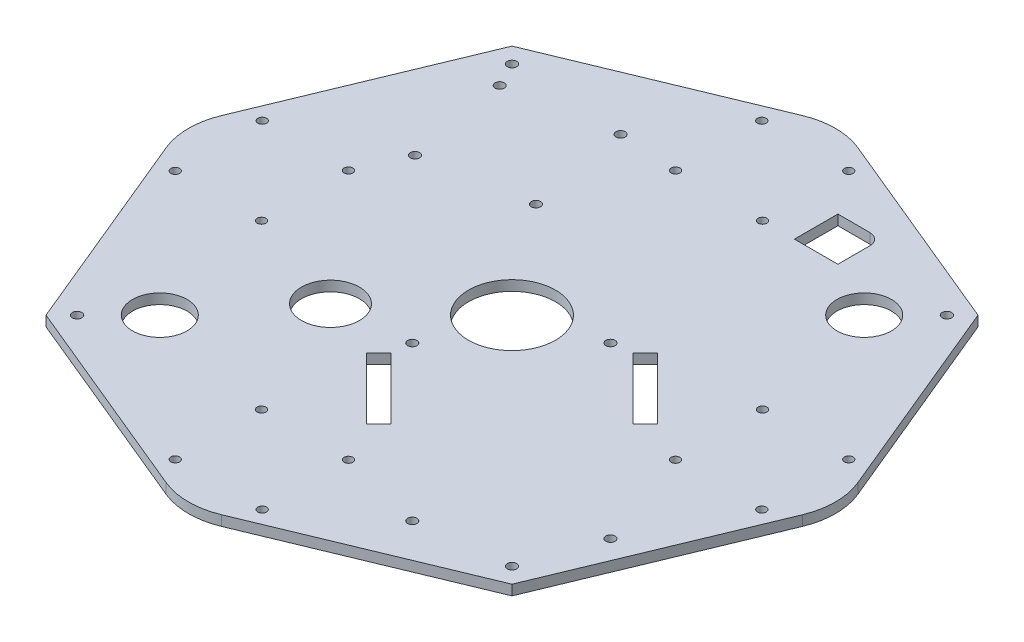
from build123d import *

# Parameters (mm, degrees)
BOSS_EXTRUDE2_DEPTH      = 3.5
CUT_EXTRUDE3_DEPTH       = 161.765145163
CUT_EXTRUDE3_DEPTH_BACK  = 161.765145163
SKETCH3_R                = 1.625
CUT_EXTRUDE6_DEPTH       = 161.765145163
CUT_EXTRUDE6_DEPTH_BACK  = 161.765145163
SKETCH6_R                = 15
SKETCH8_R                = 1.5
CUT_EXTRUDE7_DEPTH       = 3.5
CIRPATTERN1_COUNT        = 4
CUT_EXTRUDE12_DEPTH      = 161.765145163
CUT_EXTRUDE12_DEPTH_BACK = 161.765145163
SKETCH20_W               = 15
SKETCH20_H               = 15
FILLET2_R                = 25
FILLET3_R                = 4
SKETCH21_R               = 2.5
BOSS_EXTRUDE4_DEPTH      = 3
SKETCH22_R               = 1.6
CUT_EXTRUDE13_DEPTH      = 158.947840775
SKETCH24_R               = 2.4
BOSS_EXTRUDE6_DEPTH      = 3.5
CUT_EXTRUDE14_DEPTH      = 158.969207144
CUT_EXTRUDE14_DEPTH_BACK = 158.969207144
SKETCH25_R               = 1.6
CUT_EXTRUDE15_DEPTH      = 158.852844148
CUT_EXTRUDE15_DEPTH_BACK = 158.852844148
SKETCH26_R               = 9.404630818
CUT_EXTRUDE16_DEPTH      = 158.852844148
CUT_EXTRUDE16_DEPTH_BACK = 158.852844148
CUT_EXTRUDE17_DEPTH      = 158.969207144
CUT_EXTRUDE17_DEPTH_BACK = 158.969207144
SKETCH28_R               = 10


with BuildPart() as part:
    # Sketch1 → Boss-Extrude2 (new body)
    with BuildSketch(Plane(origin=(0, 0, 0), x_dir=(1, 0, 0), z_dir=(0, 1, 0))):
        Polygon((0, -113.651181031), (80.363520797, -80.363520797), (113.651181031, 0), (80.363520797, 80.363520797), (0, 113.651181031), (-80.363520797, 80.363520797), (-113.651181031, 0), (-80.363520797, -80.363520797), align=None)
    extrude(amount=BOSS_EXTRUDE2_DEPTH)

    # Sketch3 → Cut-Extrude3 (cut, two sides: drawn at the far end of the back side and taken through both)
    with BuildSketch(Plane(origin=(0, 3.5, 0), x_dir=(1, 0, 0), z_dir=(0, 1, 0)).offset(-CUT_EXTRUDE3_DEPTH_BACK)):
        with Locations(Location((-75, -75, 0), (0, 0, 270))):
            Circle(SKETCH3_R)
        with Locations(Location((75, -75, 0), (0, 0, 270))):
            Circle(SKETCH3_R)
        with Locations(Location((75, 75, 0), (0, 0, 270))):
            Circle(SKETCH3_R)
        with Locations(Location((-75, 75, 0), (0, 0, 270))):
            Circle(SKETCH3_R)
    extrude(amount=CUT_EXTRUDE3_DEPTH + CUT_EXTRUDE3_DEPTH_BACK, mode=Mode.SUBTRACT)

    # Sketch6 → Cut-Extrude6 (cut, two sides: drawn at the far end of the back side and taken through both)
    with BuildSketch(Plane(origin=(0, 3.5, 0), x_dir=(1, 0, 0), z_dir=(0, 1, 0)).offset(-CUT_EXTRUDE6_DEPTH_BACK)):
        with Locations(Location((0, 0, 0), (0, 0, 270))):
            Circle(SKETCH6_R)
    extrude(amount=CUT_EXTRUDE6_DEPTH + CUT_EXTRUDE6_DEPTH_BACK, mode=Mode.SUBTRACT)

    # Sketch8 → Cut-Extrude7 (cut)
    with BuildSketch(Plane(origin=(0, 3.5, 0), x_dir=(1, 0, 0), z_dir=(0, 1, 0))):
        with Locations(Location((-15, -71.401181031, 0), (0, 0, 270))):
            Circle(SKETCH8_R)
        with Locations(Location((15, -71.401181031, 0), (0, 0, 270))):
            Circle(SKETCH8_R)
        with Locations(Location((-15, -101.151181031, 0), (0, 0, 270))):
            Circle(SKETCH8_R)
        with Locations(Location((15, -101.151181031, 0), (0, 0, 270))):
            Circle(SKETCH8_R)
    cut_extrude7 = extrude(amount=-CUT_EXTRUDE7_DEPTH, mode=Mode.SUBTRACT)

    # CirPattern1: Cut-Extrude7 ×4 about axis
    cirpattern1_axis = Axis((0, 0, 0), (0, 1, 0))
    for i in range(1, CIRPATTERN1_COUNT):
        add(cut_extrude7.rotate(cirpattern1_axis, i * 360 / CIRPATTERN1_COUNT), mode=Mode.SUBTRACT)

    # Sketch20 → Cut-Extrude12 (cut, two sides: drawn at the far end of the back side and taken through both)
    with BuildSketch(Plane(origin=(0, 3.5, 0), x_dir=(1, 0, 0), z_dir=(0, 1, 0)).offset(-CUT_EXTRUDE12_DEPTH_BACK)):
        with Locations((33.5, 78.901181031)):
            Rectangle(SKETCH20_W, SKETCH20_H)
    extrude(amount=CUT_EXTRUDE12_DEPTH + CUT_EXTRUDE12_DEPTH_BACK, mode=Mode.SUBTRACT)

    # Fillet2
    fillet2_edges = [part.edges().sort_by_distance(p)[0] for p in [
        (-113.651181031, 1.75, 0),
        (0, 1.75, -113.651181031),
        (113.651181031, 1.75, 0),
        (0, 1.75, 113.651181031),
    ]]
    fillet(fillet2_edges, radius=FILLET2_R)

    # Fillet3
    fillet3_edges = [part.edges().sort_by_distance(p)[0] for p in [
        (41, 1.75, -86.401181031),
    ]]
    fillet(fillet3_edges, radius=FILLET3_R)

    # Sketch21 → Boss-Extrude4 (add)
    with BuildSketch(Plane.XZ):
        with Locations(Location((-8.867969273, 25.52523978, 0), (0, 0, 90))):
            Circle(SKETCH21_R)
        with Locations(Location((25.310885524, -8.653615016, 0), (0, 0, 90))):
            Circle(SKETCH21_R)
        with Locations(Location((44.25922594, 78.652434993, 0), (0, 0, 90))):
            Circle(SKETCH21_R)
        with Locations(Location((83.736431848, 49.771931307, 0), (0, 0, 90))):
            Circle(SKETCH21_R)
    extrude(amount=BOSS_EXTRUDE4_DEPTH)

    # Sketch22 → Cut-Extrude13 (cut, through all)
    with BuildSketch(Plane.XZ.offset(3)):
        with Locations(Location((83.736431848, 49.771931307, 0), (0, 0, 270))):
            Circle(SKETCH22_R)
        with Locations(Location((25.310885524, -8.653615016, 0), (0, 0, 270))):
            Circle(SKETCH22_R)
        with Locations(Location((-8.867969273, 25.52523978, 0), (0, 0, 270))):
            Circle(SKETCH22_R)
        with Locations(Location((44.25922594, 78.652434993, 0), (0, 0, 270))):
            Circle(SKETCH22_R)
    extrude(amount=-CUT_EXTRUDE13_DEPTH, mode=Mode.SUBTRACT)

    # Sketch24 → Boss-Extrude6 (add)
    with BuildSketch(Plane.XZ):
        with Locations(Location((-64.472580457, -31.0267951, 0), (0, 0, 90))):
            Circle(SKETCH24_R)
        with Locations(Location((-29.019501349, -37.278129496, 0), (0, 0, 90))):
            Circle(SKETCH24_R)
        with Locations(Location((-35.270835745, -72.731208605, 0), (0, 0, 90))):
            Circle(SKETCH24_R)
        with Locations(Location((-70.723914853, -66.479874209, 0), (0, 0, 90))):
            Circle(SKETCH24_R)
    extrude(amount=BOSS_EXTRUDE6_DEPTH)

    # Sketch25 → Cut-Extrude14 (cut, two sides: drawn at the far end of the back side and taken through both)
    with BuildSketch(Plane.XZ.offset(3.5).offset(-CUT_EXTRUDE14_DEPTH_BACK)):
        with Locations(Location((-29.019501349, -37.278129496, 0), (0, 0, 270))):
            Circle(SKETCH25_R)
        with Locations(Location((-64.472580457, -31.0267951, 0), (0, 0, 270))):
            Circle(SKETCH25_R)
        with Locations(Location((-70.723914853, -66.479874209, 0), (0, 0, 270))):
            Circle(SKETCH25_R)
        with Locations(Location((-35.270835745, -72.731208605, 0), (0, 0, 270))):
            Circle(SKETCH25_R)
    extrude(amount=CUT_EXTRUDE14_DEPTH + CUT_EXTRUDE14_DEPTH_BACK, mode=Mode.SUBTRACT)

    # Sketch26 → Cut-Extrude15 (cut, two sides: drawn at the far end of the back side and taken through both)
    with BuildSketch(Plane.XZ.offset(-CUT_EXTRUDE15_DEPTH_BACK)):
        with Locations(Location((-60.741403737, 60.741403737, 0), (0, 0, 270))):
            Circle(SKETCH26_R)
        with Locations(Location((60.741403737, -60.741403737, 0), (0, 0, 270))):
            Circle(SKETCH26_R)
    extrude(amount=CUT_EXTRUDE15_DEPTH + CUT_EXTRUDE15_DEPTH_BACK, mode=Mode.SUBTRACT)

    # Sketch27 → Cut-Extrude16 (cut, two sides: drawn at the far end of the back side and taken through both)
    with BuildSketch(Plane.XZ.offset(-CUT_EXTRUDE16_DEPTH_BACK)):
        Polygon((7.39951467, 57.553878611), (11.642155357, 53.311237924), (-9.571048078, 32.098034488), (-13.813688765, 36.340675176), align=None)
        Polygon((32.098034488, -9.571048078), (36.340675176, -13.813688765), (57.553878611, 7.39951467), (53.311237924, 11.642155357), align=None)
    extrude(amount=CUT_EXTRUDE16_DEPTH + CUT_EXTRUDE16_DEPTH_BACK, mode=Mode.SUBTRACT)

    # Sketch28 → Cut-Extrude17 (cut, two sides: drawn at the far end of the back side and taken through both)
    with BuildSketch(Plane(origin=(0, 3.5, 0), x_dir=(1, 0, 0), z_dir=(0, 1, 0)).offset(-CUT_EXTRUDE17_DEPTH_BACK)):
        with Locations(Location((-34.694923367, -27.917780902, 0), (0, 0, 270))):
            Circle(SKETCH28_R)
    extrude(amount=CUT_EXTRUDE17_DEPTH + CUT_EXTRUDE17_DEPTH_BACK, mode=Mode.SUBTRACT)


solid = part.part
